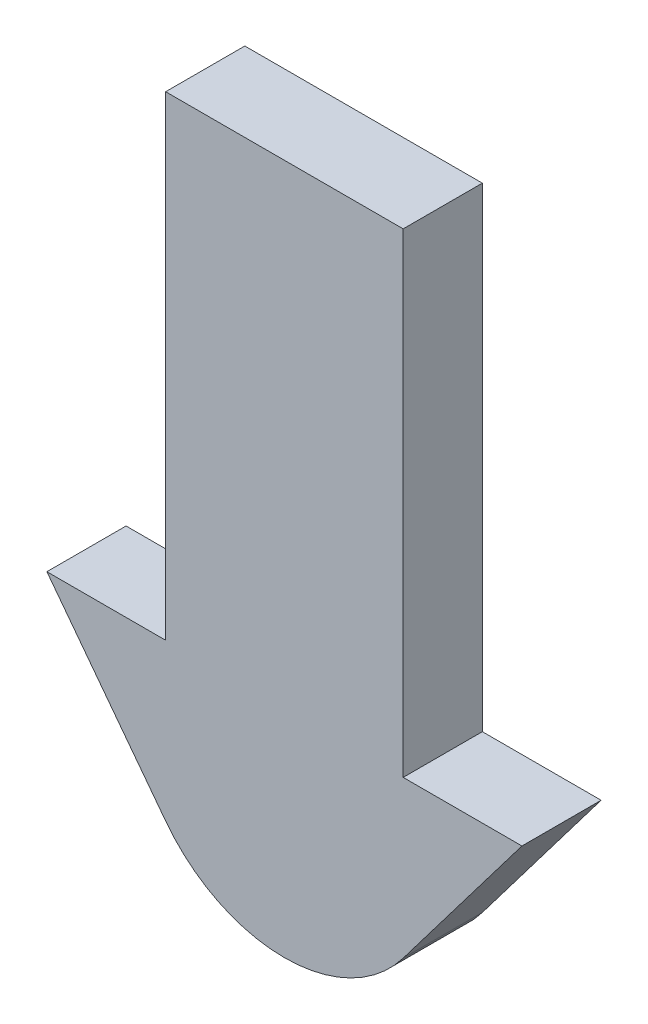
from build123d import *

# Parameters (mm, degrees)
BOSS_EXTRUDE1_DEPTH = 10


with BuildPart() as part:
    # Sketch1 → Boss-Extrude1 (new body)
    with BuildSketch(Plane.XY):
        with BuildLine():
            Line((-15, 90), (15, 90))
            Line((15, 90), (15, 30))
            Line((15, 30), (30, 30))
            Line((30, 30), (15, 10.228365212))
            ThreePointArc((15, 10.228365212), (0, 2.780053895), (-15, 10.228365212))
            Line((-15, 10.228365212), (-30, 30))
            Line((-30, 30), (-15, 30))
            Line((-15, 30), (-15, 90))
        make_face()
    extrude(amount=BOSS_EXTRUDE1_DEPTH)


solid = part.part
